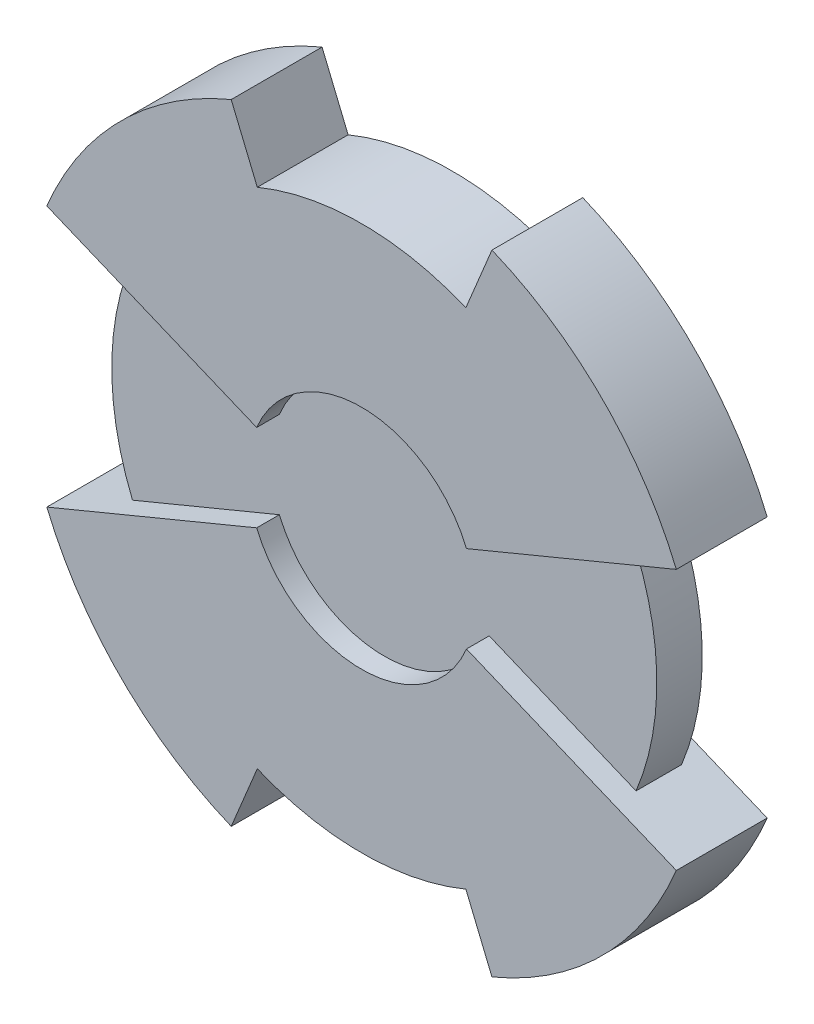
from build123d import *

# Parameters (mm, degrees)
BOSS_EXTRUDE1_DEPTH   = 10
BOSS_EXTRUDE1_2_DEPTH = 10
BOSS_EXTRUDE2_DEPTH   = 5


with BuildPart() as part:
    # Sketch1 → Boss-Extrude1 (new, symmetric)
    with BuildSketch(Plane.XY):
        with BuildLine():
            ThreePointArc((23.096988313, -9.567085809), (0, -25), (-23.096988313, -9.567085809))
            Line((-23.096988313, -9.567085809), (-69.290964938, -28.701257427))
            ThreePointArc((-69.290964938, -28.701257427), (-53.033008589, -53.033008589), (-28.701257427, -69.290964938))
            Line((-28.701257427, -69.290964938), (-22.961005942, -55.432771951))
            ThreePointArc((-22.961005942, -55.432771951), (0, -60), (22.961005942, -55.432771951))
            Line((22.961005942, -55.432771951), (28.701257427, -69.290964938))
            ThreePointArc((28.701257427, -69.290964938), (53.033008589, -53.033008589), (69.290964938, -28.701257427))
            Line((69.290964938, -28.701257427), (23.096988313, -9.567085809))
        make_face()
    extrude(amount=BOSS_EXTRUDE1_DEPTH, both=True)



with BuildPart() as body_2:
    # Sketch1 → Boss-Extrude1 2 (new, symmetric)
    with BuildSketch(Plane.XY):
        with BuildLine():
            ThreePointArc((69.290964938, 28.701257427), (53.033008589, 53.033008589), (28.701257427, 69.290964938))
            Line((28.701257427, 69.290964938), (22.961005942, 55.432771951))
            ThreePointArc((22.961005942, 55.432771951), (0, 60), (-22.961005942, 55.432771951))
            Line((-22.961005942, 55.432771951), (-28.701257427, 69.290964938))
            ThreePointArc((-28.701257427, 69.290964938), (-53.033008589, 53.033008589), (-69.290964938, 28.701257427))
            Line((-69.290964938, 28.701257427), (-23.096988313, 9.567085809))
            ThreePointArc((-23.096988313, 9.567085809), (0, 25), (23.096988313, 9.567085809))
            Line((23.096988313, 9.567085809), (69.290964938, 28.701257427))
        make_face()
    extrude(amount=BOSS_EXTRUDE1_2_DEPTH, both=True)


with BuildPart() as part_1:
    add(part.part)

    add(body_2.part)  # Boss-Extrude2 merges body 2
    # Sketch1<3> → Boss-Extrude2 (add, symmetric)
    with BuildSketch(Plane.XY):
        with BuildLine():
            ThreePointArc((-23.096988313, -9.567085809), (0, -25), (23.096988313, -9.567085809))
            Line((23.096988313, -9.567085809), (55.432771951, -22.961005942))
            ThreePointArc((55.432771951, -22.961005942), (58.847116824, -11.705419321), (60, 0))
            ThreePointArc((60, 0), (58.847116824, 11.705419321), (55.432771951, 22.961005942))
            Line((55.432771951, 22.961005942), (23.096988313, 9.567085809))
            ThreePointArc((23.096988313, 9.567085809), (0, 25), (-23.096988313, 9.567085809))
            Line((-23.096988313, 9.567085809), (-55.432771951, 22.961005942))
            ThreePointArc((-55.432771951, 22.961005942), (-60, 0), (-55.432771951, -22.961005942))
            Line((-55.432771951, -22.961005942), (-23.096988313, -9.567085809))
        make_face()
    extrude(amount=BOSS_EXTRUDE2_DEPTH, both=True)


solid = part_1.part
